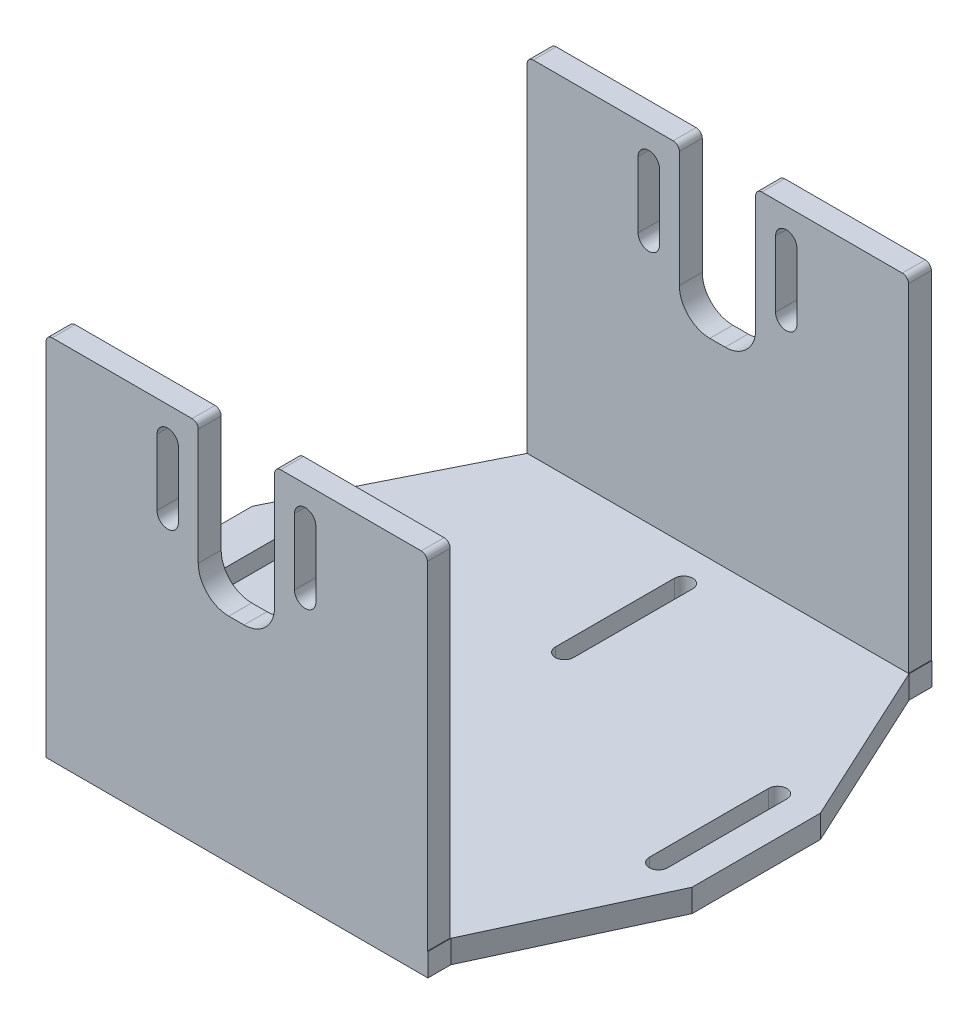
from build123d import *

# Parameters (mm, degrees)
BOSS_EXTRUDE6_DEPTH = 7.5
BOSS_EXTRUDE7_DEPTH = 7.5


with BuildPart() as part:
    # Sketch1 → Boss-Extrude6 (new body)
    with BuildSketch(Plane(origin=(0, 0, 0), x_dir=(1, 0, 0), z_dir=(0, 1, 0))):
        Polygon((0, -7.5), (125, -7.5), (125, 0), (150, 54), (150, 96), (125, 150), (125, 157.5), (0, 157.5), (0, 150), (-30, 90), (-30, 60), (0, 0), align=None)
        with BuildLine():
            Line((134.5, 55.5), (134.5, 94.5))
            ThreePointArc((134.5, 94.5), (137.5, 97.5), (140.5, 94.5))
            Line((140.5, 94.5), (140.5, 55.5))
            ThreePointArc((140.5, 55.5), (137.5, 52.5), (134.5, 55.5))
        make_face(mode=Mode.SUBTRACT)
        with BuildLine():
            Line((-17, 55.5), (-17, 94.5))
            ThreePointArc((-17, 94.5), (-14, 97.5), (-11, 94.5))
            Line((-11, 94.5), (-11, 55.5))
            ThreePointArc((-11, 55.5), (-14, 52.5), (-17, 55.5))
        make_face(mode=Mode.SUBTRACT)
        with BuildLine():
            Line((59.5, 11), (59.5, 50))
            ThreePointArc((59.5, 50), (62.5, 53), (65.5, 50))
            Line((65.5, 50), (65.5, 11))
            ThreePointArc((65.5, 11), (62.5, 8), (59.5, 11))
        make_face(mode=Mode.SUBTRACT)
        with BuildLine():
            Line((65.5, 138.705746838), (65.5, 99.705746838))
            ThreePointArc((65.5, 99.705746838), (62.5, 96.705746838), (59.5, 99.705746838))
            Line((59.5, 99.705746838), (59.5, 138.705746838))
            ThreePointArc((59.5, 138.705746838), (62.5, 141.705746839), (65.5, 138.705746838))
        make_face(mode=Mode.SUBTRACT)
    extrude(amount=BOSS_EXTRUDE6_DEPTH)

    # Sketch2 → Boss-Extrude7 (add)
    with BuildSketch(Plane.XY):
        with BuildLine():
            Line((0, 0), (0, 118))
            ThreePointArc((0, 118), (0.585786438, 119.414213562), (2, 120))
            Line((2, 120), (47.812758192, 120))
            ThreePointArc((47.812758192, 120), (49.226971755, 119.414213562), (49.812758192, 118))
            Line((49.812758192, 118), (49.812758192, 80))
            ThreePointArc((49.812758192, 80), (52.74169038, 72.928932188), (59.812758192, 70))
            Line((59.812758192, 70), (64.812758192, 70))
            ThreePointArc((64.812758192, 70), (71.883826004, 72.928932188), (74.812758192, 80))
            Line((74.812758192, 80), (74.812758192, 118))
            ThreePointArc((74.812758192, 118), (75.39854463, 119.414213562), (76.812758192, 120))
            Line((76.812758192, 120), (122.812758192, 120))
            ThreePointArc((122.812758192, 120), (124.226971755, 119.414213562), (124.812758192, 118))
            Line((124.812758192, 118), (124.812758192, 0))
            Line((124.812758192, 0), (0, 0))
        make_face()
        with BuildLine():
            Line((36.312758192, 88.190430343), (36.312758192, 109.809569657))
            ThreePointArc((36.312758192, 109.809569657), (39.812758192, 113.309569657), (43.312758192, 109.809569657))
            Line((43.312758192, 109.809569657), (43.312758192, 88.190430343))
            ThreePointArc((43.312758192, 88.190430343), (39.812758192, 84.690430343), (36.312758192, 88.190430343))
        make_face(mode=Mode.SUBTRACT)
        with BuildLine():
            Line((88.312758192, 88.190430343), (88.312758192, 109.809569657))
            ThreePointArc((88.312758192, 109.809569657), (84.812758192, 113.309569657), (81.312758192, 109.809569657))
            Line((81.312758192, 109.809569657), (81.312758192, 88.190430343))
            ThreePointArc((81.312758192, 88.190430343), (84.812758192, 84.690430343), (88.312758192, 88.190430343))
        make_face(mode=Mode.SUBTRACT)
    boss_extrude7 = extrude(amount=BOSS_EXTRUDE7_DEPTH)

    # Mirror1: Boss-Extrude7 across plane
    add(boss_extrude7.mirror(Plane(origin=(0, 0, -75), x_dir=(1, 0, 0), z_dir=(0, 0, -1))))


solid = part.part
